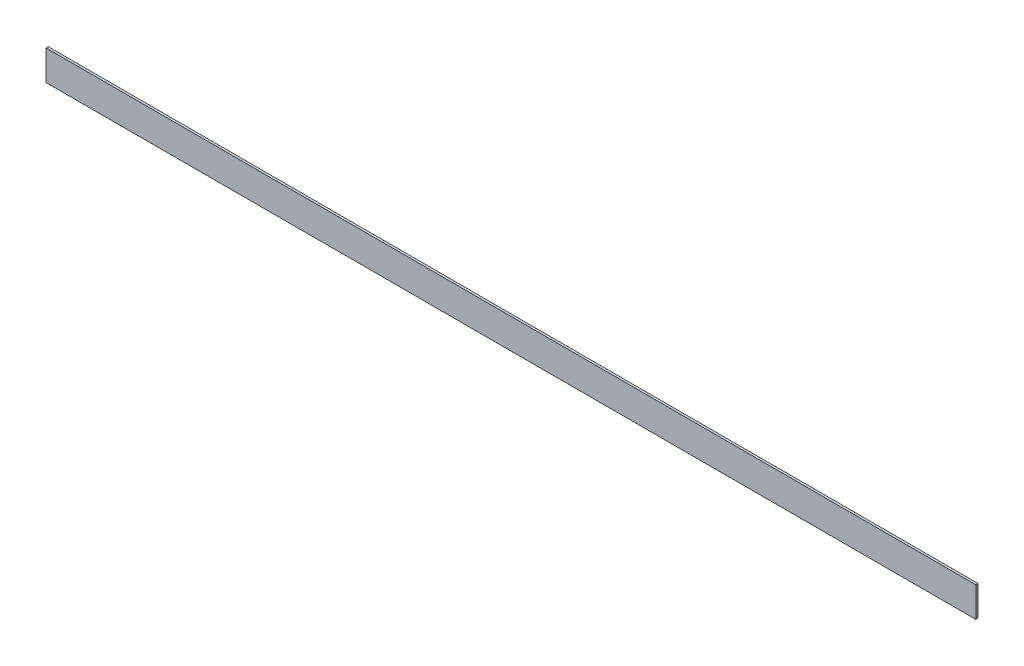
from build123d import *

# Parameters (mm, degrees)
PRESS_UC_RAFI_RAF_BUK_ON_1_START = -20
SKETCH1_W                        = 620
SKETCH1_H                        = 20
PRESS_UC_RAFI_RAF_BUK_ON_1_DEPTH = 1.5


with BuildPart() as part:
    # Sketch1 → PRESS_uc_rafi_raf_buk_on_1 (new body)
    with BuildSketch(Plane.XY.offset(PRESS_UC_RAFI_RAF_BUK_ON_1_START)):
        with Locations((350, 1142)):
            Rectangle(SKETCH1_W, SKETCH1_H)
    extrude(amount=-PRESS_UC_RAFI_RAF_BUK_ON_1_DEPTH)


solid = part.part
